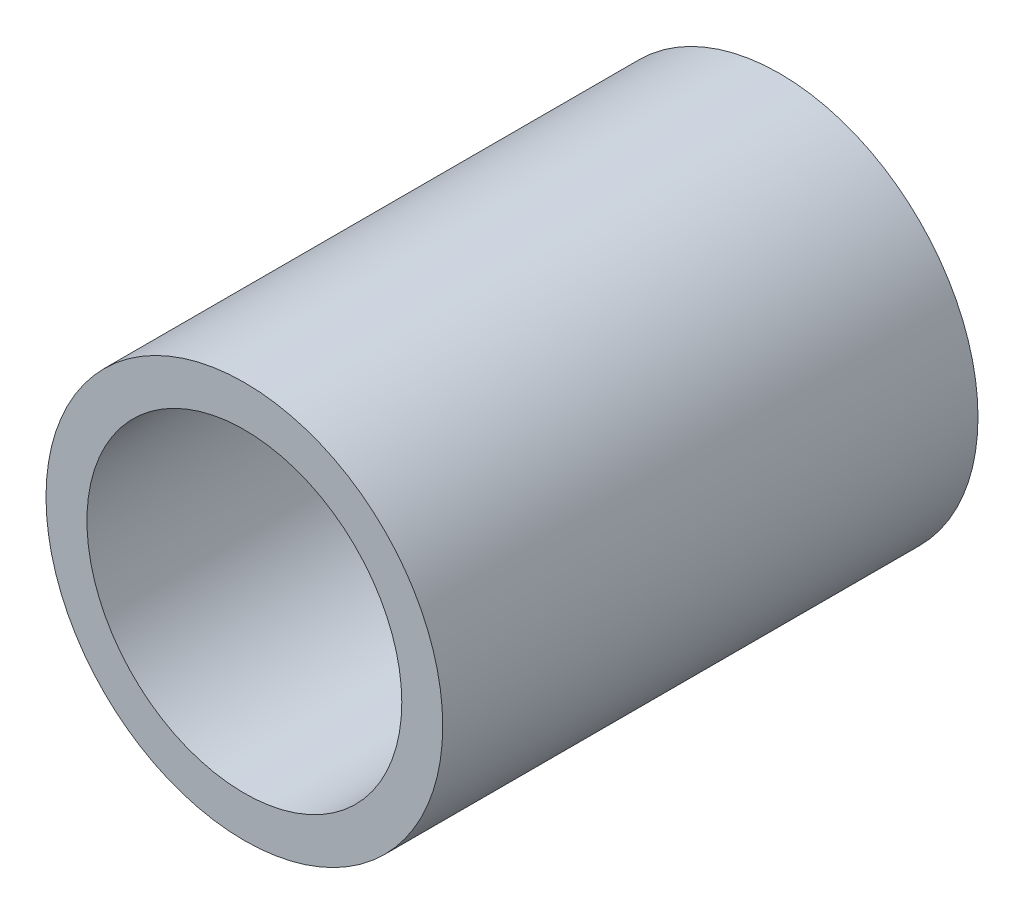
from build123d import *

# Parameters (mm, degrees)
SKETCH1_R           = 6.3
SKETCH1_R_2         = 5
BOSS_EXTRUDE1_DEPTH = 17


with BuildPart() as part:
    # Sketch1 → Boss-Extrude1 (new body)
    with BuildSketch(Plane.XY):
        Circle(SKETCH1_R)
        Circle(SKETCH1_R_2, mode=Mode.SUBTRACT)
    extrude(amount=BOSS_EXTRUDE1_DEPTH)


solid = part.part
